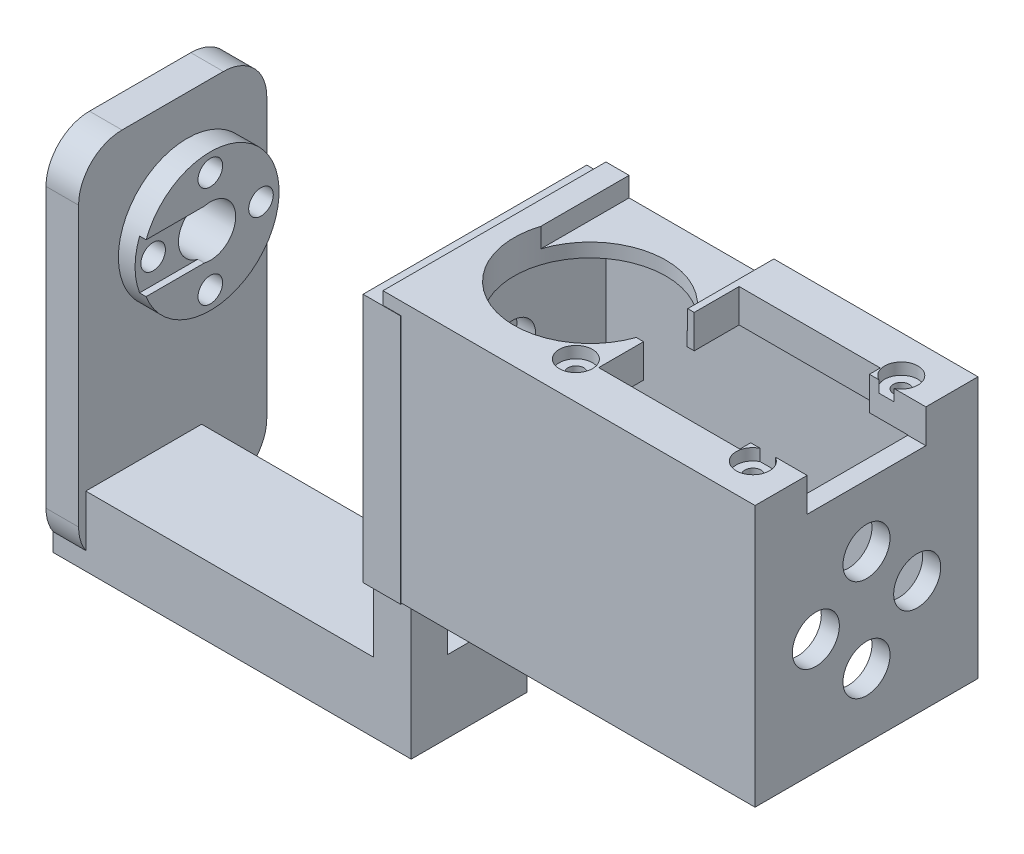
from build123d import *

# Parameters (mm, degrees)
S_PRISM1_W      = 30.9
S_PRISM1_H      = 34.5
BOSS_1_DEPTH    = 5.2
S_CYL2_R        = 9.5
BOSS_2_DEPTH    = 3.2
BOSS_3_DEPTH    = 4.5
S_BOX4_W        = 2.5
S_BOX4_H        = 36.1
BOSS_4_DEPTH    = 30.8
S_BOX5_W        = 2.5
S_BOX5_H        = 36.1
BOSS_5_DEPTH    = 30.8
S_BOX6_W        = 51.4
S_BOX6_H        = 36.1
BOSS_6_DEPTH    = 2.5
S_BOX7_W        = 51.4
S_BOX7_H        = 36.1
BOSS_7_DEPTH    = 2.5
S_BOX8_W        = 51.4
S_BOX8_H        = 4.6
BOSS_8_DEPTH    = 30.8
S_BOX9_W        = 5.2
S_BOX9_H        = 9.8
BOSS_9_DEPTH    = 5
S_BOX10_W       = 5.2
S_BOX10_H       = 10
BOSS_10_DEPTH   = 16
S_BOX11_W       = 49.45
S_BOX11_H       = 9.6
BOSS_11_DEPTH   = 16
S_HOLE12_R      = 3.5
HOLE_12_DEPTH   = 5.4
S_HOLE13_R      = 1.7
HOLE_13_DEPTH   = 5.4
S_HOLE14_R      = 1.7
HOLE_14_DEPTH   = 5.4
S_HOLE15_R      = 1.7
HOLE_15_DEPTH   = 5.4
S_HOLE16_R      = 1.7
HOLE_16_DEPTH   = 5.4
S_HOLE17_R      = 3.2
HOLE_17_DEPTH   = 2.7
S_HOLE18_R      = 3.2
HOLE_18_DEPTH   = 2.7
S_HOLE19_R      = 3.2
HOLE_19_DEPTH   = 2.7
S_HOLE20_R      = 3.2
HOLE_20_DEPTH   = 2.7
S_HOLE21_R      = 3.5
HOLE_21_DEPTH   = 7.9
S_HOLE22_R      = 1.7
HOLE_22_DEPTH   = 7.9
S_HOLE23_R      = 1.7
HOLE_23_DEPTH   = 7.9
S_HOLE24_R      = 1.7
HOLE_24_DEPTH   = 7.9
S_HOLE25_R      = 1.7
HOLE_25_DEPTH   = 7.9
S_HOLE26_R      = 3.2
HOLE_26_DEPTH   = 2.1
S_HOLE27_R      = 3.2
HOLE_27_DEPTH   = 2.1
S_HOLE28_R      = 3.2
HOLE_28_DEPTH   = 2.1
S_HOLE29_R      = 3.2
HOLE_29_DEPTH   = 2.1
S_CUT30_W       = 1
S_CUT30_H       = 6.8
POCKET_30_DEPTH = 10
S_HOLE31_R      = 10.5
HOLE_31_DEPTH   = 4.8
S_CUT32_W       = 19.5
S_CUT32_H       = 4.75
POCKET_32_DEPTH = 19.4
S_CUT33_W       = 8.3
S_CUT33_H       = 4.75
POCKET_33_DEPTH = 16.4
S_CUT34_W       = 11
S_CUT34_H       = 4.75
POCKET_34_DEPTH = 7
S_CUT35_W       = 20
S_CUT35_H       = 2.9
POCKET_35_DEPTH = 15.9
S_HOLE36_R      = 1.1
HOLE_36_DEPTH   = 4.8
S_HOLE37_R      = 2.3
HOLE_37_DEPTH   = 1.7
S_HOLE38_R      = 1.1
HOLE_38_DEPTH   = 4.8
S_HOLE39_R      = 2.3
HOLE_39_DEPTH   = 1.7
S_HOLE40_R      = 1.1
HOLE_40_DEPTH   = 4.8
S_HOLE41_R      = 2.3
HOLE_41_DEPTH   = 1.7
S_HOLE42_R      = 3.25
HOLE_42_DEPTH   = 2.7
S_HOLE43_R      = 3.25
HOLE_43_DEPTH   = 2.7
S_HOLE44_R      = 3.25
HOLE_44_DEPTH   = 2.7
S_HOLE45_R      = 3.25
HOLE_45_DEPTH   = 2.7


with BuildPart() as part:
    # S_prism1 → Boss_1 (new body)
    with BuildSketch(Plane(origin=(-15.9, 0, 0), x_dir=(0, 0, -1), z_dir=(1, 0, 0))):
        with Locations((0, 1.2)):
            Rectangle(S_PRISM1_W, S_PRISM1_H)
    extrude(amount=BOSS_1_DEPTH)

    # S_box4 → Boss_4 (add)
    with BuildSketch(Plane.XY.offset(-15.4)):
        with Locations((-11.95, 2.15)):
            Rectangle(S_BOX4_W, S_BOX4_H)
    extrude(amount=BOSS_4_DEPTH)



with BuildPart() as body_2:
    # S_cyl2 → Boss_2 (new body)
    with BuildSketch(Plane(origin=(-55.65, 0, 0), x_dir=(0, 0, -1), z_dir=(1, 0, 0))):
        Circle(S_CYL2_R)
    extrude(amount=BOSS_2_DEPTH)

    # S_prism3 → Boss_3 (add)
    with BuildSketch(Plane(origin=(-60.15, 0, 0), x_dir=(0, 0, -1), z_dir=(1, 0, 0))):
        with BuildLine():
            Line((11, 9), (11, -29.5))
            ThreePointArc((11, -29.5), (9.2426, -33.7426), (5, -35.5))
            Line((5, -35.5), (-9, -35.5))
            ThreePointArc((-9, -35.5), (-13.2426, -33.7426), (-15, -29.5))
            Line((-15, -29.5), (-15, 9))
            ThreePointArc((-15, 9), (-13.2426, 13.2426), (-9, 15))
            Line((-9, 15), (5, 15))
            ThreePointArc((5, 15), (9.2426, 13.2426), (11, 9))
        make_face()
    extrude(amount=BOSS_3_DEPTH)


with BuildPart() as body_3:
    # S_box5 → Boss_5 (new body)
    with BuildSketch(Plane.XY.offset(-15.4)):
        with Locations((36.95, 2.15)):
            Rectangle(S_BOX5_W, S_BOX5_H)
    extrude(amount=BOSS_5_DEPTH)


with BuildPart() as part_1:
    add(part.part)

    add(body_3.part)  # Boss_6 merges body 3
    # S_box6 → Boss_6 (add)
    with BuildSketch(Plane.XY.offset(-15.4)):
        with Locations((12.5, 2.15)):
            Rectangle(S_BOX6_W, S_BOX6_H)
    extrude(amount=BOSS_6_DEPTH)

    # S_box7 → Boss_7 (add)
    with BuildSketch(Plane.XY.offset(12.9)):
        with Locations((12.5, 2.15)):
            Rectangle(S_BOX7_W, S_BOX7_H)
    extrude(amount=BOSS_7_DEPTH)

    # S_box8 → Boss_8 (add)
    with BuildSketch(Plane.XY.offset(-15.4)):
        with Locations((12.5, 17.9)):
            Rectangle(S_BOX8_W, S_BOX8_H)
    extrude(amount=BOSS_8_DEPTH)

    # S_box9 → Boss_9 (add)
    with BuildSketch(Plane.XY.offset(9)):
        with Locations((-13.3, -20.9)):
            Rectangle(S_BOX9_W, S_BOX9_H)
    extrude(amount=BOSS_9_DEPTH)

    # S_box10 → Boss_10 (add)
    with BuildSketch(Plane.XY.offset(-2)):
        with Locations((-13.3, -30.3)):
            Rectangle(S_BOX10_W, S_BOX10_H)
    extrude(amount=BOSS_10_DEPTH)


    add(body_2.part)  # Boss_11 merges body 2
    # S_box11 → Boss_11 (add)
    with BuildSketch(Plane.XY.offset(-2)):
        with Locations((-35.425, -30.5)):
            Rectangle(S_BOX11_W, S_BOX11_H)
    extrude(amount=BOSS_11_DEPTH)

    # S_hole12 → Hole_12 (cut)
    with BuildSketch(Plane(origin=(-16, 0, 0), x_dir=(0, 0, -1), z_dir=(1, 0, 0))):
        with Locations(Location((0, 0, 0), (0, 0, 180))):
            Circle(S_HOLE12_R)
    extrude(amount=HOLE_12_DEPTH, mode=Mode.SUBTRACT)

    # S_hole13 → Hole_13 (cut)
    with BuildSketch(Plane(origin=(-16, 0, 0), x_dir=(0, 0, -1), z_dir=(1, 0, 0))):
        with Locations(Location((0, -7, 0), (0, 0, 180))):
            Circle(S_HOLE13_R)
    extrude(amount=HOLE_13_DEPTH, mode=Mode.SUBTRACT)

    # S_hole14 → Hole_14 (cut)
    with BuildSketch(Plane(origin=(-16, 0, 0), x_dir=(0, 0, -1), z_dir=(1, 0, 0))):
        with Locations(Location((-7, 0, 0), (0, 0, 180))):
            Circle(S_HOLE14_R)
    extrude(amount=HOLE_14_DEPTH, mode=Mode.SUBTRACT)

    # S_hole15 → Hole_15 (cut)
    with BuildSketch(Plane(origin=(-16, 0, 0), x_dir=(0, 0, -1), z_dir=(1, 0, 0))):
        with Locations(Location((0, 7, 0), (0, 0, 180))):
            Circle(S_HOLE15_R)
    extrude(amount=HOLE_15_DEPTH, mode=Mode.SUBTRACT)

    # S_hole16 → Hole_16 (cut)
    with BuildSketch(Plane(origin=(-16, 0, 0), x_dir=(0, 0, -1), z_dir=(1, 0, 0))):
        with Locations(Location((7, 0, 0), (0, 0, 180))):
            Circle(S_HOLE16_R)
    extrude(amount=HOLE_16_DEPTH, mode=Mode.SUBTRACT)

    # S_hole17 → Hole_17 (cut)
    with BuildSketch(Plane(origin=(-13.3, 0, 0), x_dir=(0, 0, -1), z_dir=(1, 0, 0))):
        with Locations(Location((0, -7, 0), (0, 0, 180))):
            Circle(S_HOLE17_R)
    extrude(amount=HOLE_17_DEPTH, mode=Mode.SUBTRACT)

    # S_hole18 → Hole_18 (cut)
    with BuildSketch(Plane(origin=(-13.3, 0, 0), x_dir=(0, 0, -1), z_dir=(1, 0, 0))):
        with Locations(Location((-7, 0, 0), (0, 0, 180))):
            Circle(S_HOLE18_R)
    extrude(amount=HOLE_18_DEPTH, mode=Mode.SUBTRACT)

    # S_hole19 → Hole_19 (cut)
    with BuildSketch(Plane(origin=(-13.3, 0, 0), x_dir=(0, 0, -1), z_dir=(1, 0, 0))):
        with Locations(Location((0, 7, 0), (0, 0, 180))):
            Circle(S_HOLE19_R)
    extrude(amount=HOLE_19_DEPTH, mode=Mode.SUBTRACT)

    # S_hole20 → Hole_20 (cut)
    with BuildSketch(Plane(origin=(-13.3, 0, 0), x_dir=(0, 0, -1), z_dir=(1, 0, 0))):
        with Locations(Location((7, 0, 0), (0, 0, 180))):
            Circle(S_HOLE20_R)
    extrude(amount=HOLE_20_DEPTH, mode=Mode.SUBTRACT)

    # S_hole21 → Hole_21 (cut)
    with BuildSketch(Plane(origin=(-60.25, 0, 0), x_dir=(0, 0, -1), z_dir=(1, 0, 0))):
        with Locations(Location((0, 0, 0), (0, 0, 180))):
            Circle(S_HOLE21_R)
    extrude(amount=HOLE_21_DEPTH, mode=Mode.SUBTRACT)

    # S_hole22 → Hole_22 (cut)
    with BuildSketch(Plane(origin=(-60.25, 0, 0), x_dir=(0, 0, -1), z_dir=(1, 0, 0))):
        with Locations(Location((0, -7, 0), (0, 0, 180))):
            Circle(S_HOLE22_R)
    extrude(amount=HOLE_22_DEPTH, mode=Mode.SUBTRACT)

    # S_hole23 → Hole_23 (cut)
    with BuildSketch(Plane(origin=(-60.25, 0, 0), x_dir=(0, 0, -1), z_dir=(1, 0, 0))):
        with Locations(Location((-7, 0, 0), (0, 0, 180))):
            Circle(S_HOLE23_R)
    extrude(amount=HOLE_23_DEPTH, mode=Mode.SUBTRACT)

    # S_hole24 → Hole_24 (cut)
    with BuildSketch(Plane(origin=(-60.25, 0, 0), x_dir=(0, 0, -1), z_dir=(1, 0, 0))):
        with Locations(Location((0, 7, 0), (0, 0, 180))):
            Circle(S_HOLE24_R)
    extrude(amount=HOLE_24_DEPTH, mode=Mode.SUBTRACT)

    # S_hole25 → Hole_25 (cut)
    with BuildSketch(Plane(origin=(-60.25, 0, 0), x_dir=(0, 0, -1), z_dir=(1, 0, 0))):
        with Locations(Location((7, 0, 0), (0, 0, 180))):
            Circle(S_HOLE25_R)
    extrude(amount=HOLE_25_DEPTH, mode=Mode.SUBTRACT)

    # S_hole26 → Hole_26 (cut)
    with BuildSketch(Plane(origin=(-60.25, 0, 0), x_dir=(0, 0, -1), z_dir=(1, 0, 0))):
        with Locations(Location((0, -7, 0), (0, 0, 180))):
            Circle(S_HOLE26_R)
    extrude(amount=HOLE_26_DEPTH, mode=Mode.SUBTRACT)

    # S_hole27 → Hole_27 (cut)
    with BuildSketch(Plane(origin=(-60.25, 0, 0), x_dir=(0, 0, -1), z_dir=(1, 0, 0))):
        with Locations(Location((-7, 0, 0), (0, 0, 180))):
            Circle(S_HOLE27_R)
    extrude(amount=HOLE_27_DEPTH, mode=Mode.SUBTRACT)

    # S_hole28 → Hole_28 (cut)
    with BuildSketch(Plane(origin=(-60.25, 0, 0), x_dir=(0, 0, -1), z_dir=(1, 0, 0))):
        with Locations(Location((0, 7, 0), (0, 0, 180))):
            Circle(S_HOLE28_R)
    extrude(amount=HOLE_28_DEPTH, mode=Mode.SUBTRACT)

    # S_hole29 → Hole_29 (cut)
    with BuildSketch(Plane(origin=(-60.25, 0, 0), x_dir=(0, 0, -1), z_dir=(1, 0, 0))):
        with Locations(Location((7, 0, 0), (0, 0, 180))):
            Circle(S_HOLE29_R)
    extrude(amount=HOLE_29_DEPTH, mode=Mode.SUBTRACT)

    # S_cut30 → Pocket_30 (cut)
    with BuildSketch(Plane.XY):
        with Locations((-52.85, 0)):
            Rectangle(S_CUT30_W, S_CUT30_H)
    extrude(amount=POCKET_30_DEPTH, mode=Mode.SUBTRACT)

    # S_hole31 → Hole_31 (cut)
    with BuildSketch(Plane(origin=(0, 15.5, 0), x_dir=(1, 0, 0), z_dir=(0, 1, 0))):
        with Locations(Location((0, 0, 0), (0, 0, 90))):
            Circle(S_HOLE31_R)
    extrude(amount=HOLE_31_DEPTH, mode=Mode.SUBTRACT)

    # S_cut32 → Pocket_32 (cut)
    with BuildSketch(Plane.XY.offset(-9.7)):
        with Locations((20.65, 17.925)):
            Rectangle(S_CUT32_W, S_CUT32_H)
    extrude(amount=POCKET_32_DEPTH, mode=Mode.SUBTRACT)

    # S_cut33 → Pocket_33 (cut)
    with BuildSketch(Plane.XY.offset(-8.2)):
        with Locations((34.55, 17.925)):
            Rectangle(S_CUT33_W, S_CUT33_H)
    extrude(amount=POCKET_33_DEPTH, mode=Mode.SUBTRACT)

    # S_cut34 → Pocket_34 (cut)
    with BuildSketch(Plane.XY.offset(-3.5)):
        with Locations((5.5, 17.925)):
            Rectangle(S_CUT34_W, S_CUT34_H)
    extrude(amount=POCKET_34_DEPTH, mode=Mode.SUBTRACT)

    # S_cut35 → Pocket_35 (cut)
    with BuildSketch(Plane.XY.offset(-15.9)):
        with Locations((0, 18.95)):
            Rectangle(S_CUT35_W, S_CUT35_H)
    extrude(amount=POCKET_35_DEPTH, mode=Mode.SUBTRACT)

    # S_hole36 → Hole_36 (cut)
    with BuildSketch(Plane(origin=(0, 15.5, 0), x_dir=(1, 0, 0), z_dir=(0, 1, 0))):
        with Locations(Location((8.3, -10.25, 0), (0, 0, 90))):
            Circle(S_HOLE36_R)
    extrude(amount=HOLE_36_DEPTH, mode=Mode.SUBTRACT)

    # S_hole37 → Hole_37 (cut)
    with BuildSketch(Plane(origin=(0, 18.6, 0), x_dir=(1, 0, 0), z_dir=(0, 1, 0))):
        with Locations(Location((8.3, -10.25, 0), (0, 0, 90))):
            Circle(S_HOLE37_R)
    extrude(amount=HOLE_37_DEPTH, mode=Mode.SUBTRACT)

    # S_hole38 → Hole_38 (cut)
    with BuildSketch(Plane(origin=(0, 15.5, 0), x_dir=(1, 0, 0), z_dir=(0, 1, 0))):
        with Locations(Location((32.75, 10.25, 0), (0, 0, 90))):
            Circle(S_HOLE38_R)
    extrude(amount=HOLE_38_DEPTH, mode=Mode.SUBTRACT)

    # S_hole39 → Hole_39 (cut)
    with BuildSketch(Plane(origin=(0, 18.6, 0), x_dir=(1, 0, 0), z_dir=(0, 1, 0))):
        with Locations((32.75, 10.25)):
            Circle(S_HOLE39_R)
    extrude(amount=HOLE_39_DEPTH, mode=Mode.SUBTRACT)

    # S_hole40 → Hole_40 (cut)
    with BuildSketch(Plane(origin=(0, 15.5, 0), x_dir=(1, 0, 0), z_dir=(0, 1, 0))):
        with Locations(Location((32.75, -10.25, 0), (0, 0, 90))):
            Circle(S_HOLE40_R)
    extrude(amount=HOLE_40_DEPTH, mode=Mode.SUBTRACT)

    # S_hole41 → Hole_41 (cut)
    with BuildSketch(Plane(origin=(0, 18.6, 0), x_dir=(1, 0, 0), z_dir=(0, 1, 0))):
        with Locations((32.75, -10.25)):
            Circle(S_HOLE41_R)
    extrude(amount=HOLE_41_DEPTH, mode=Mode.SUBTRACT)

    # S_hole42 → Hole_42 (cut)
    with BuildSketch(Plane(origin=(35.6, 0, 0), x_dir=(0, 0, -1), z_dir=(1, 0, 0))):
        with Locations(Location((0, -7, 0), (0, 0, 180))):
            Circle(S_HOLE42_R)
    extrude(amount=HOLE_42_DEPTH, mode=Mode.SUBTRACT)

    # S_hole43 → Hole_43 (cut)
    with BuildSketch(Plane(origin=(35.6, 0, 0), x_dir=(0, 0, -1), z_dir=(1, 0, 0))):
        with Locations(Location((-7, 0, 0), (0, 0, 180))):
            Circle(S_HOLE43_R)
    extrude(amount=HOLE_43_DEPTH, mode=Mode.SUBTRACT)

    # S_hole44 → Hole_44 (cut)
    with BuildSketch(Plane(origin=(35.6, 0, 0), x_dir=(0, 0, -1), z_dir=(1, 0, 0))):
        with Locations(Location((0, 7, 0), (0, 0, 180))):
            Circle(S_HOLE44_R)
    extrude(amount=HOLE_44_DEPTH, mode=Mode.SUBTRACT)

    # S_hole45 → Hole_45 (cut)
    with BuildSketch(Plane(origin=(35.6, 0, 0), x_dir=(0, 0, -1), z_dir=(1, 0, 0))):
        with Locations(Location((7, 0, 0), (0, 0, 180))):
            Circle(S_HOLE45_R)
    extrude(amount=HOLE_45_DEPTH, mode=Mode.SUBTRACT)


solid = part_1.part
